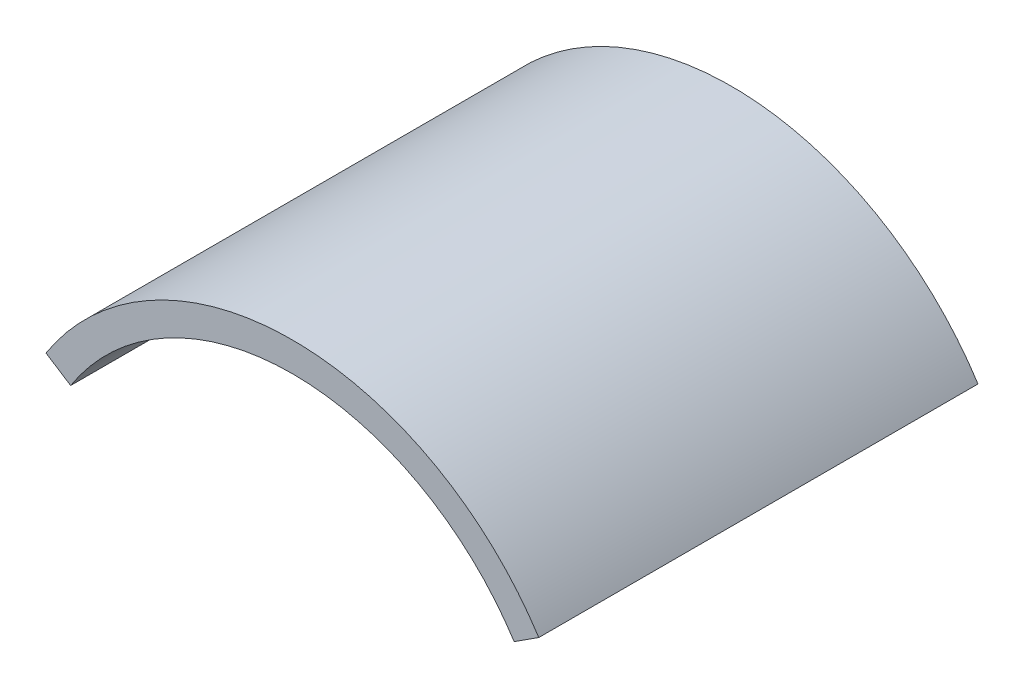
from build123d import *


with BuildPart() as part:
    # Sensor Cover: sweep along a path in Sketch5
    with BuildLine(Plane(origin=(0, 0, 0), x_dir=(1, 0, 0), z_dir=(0, 1, 0))) as sensor_cover_path:
        Line((0, 0), (0, 30))
    # Sketch4 → Sensor Cover (sweep)
    with BuildSketch(Plane.XY):
        with BuildLine():
            Line((-16.829272678, 10.806275082), (-15.14634541, 9.725647574))
            ThreePointArc((-15.14634541, 9.725647574), (0, 18), (15.14634541, 9.725647574))
            Line((15.14634541, 9.725647574), (16.829272678, 10.806275082))
            ThreePointArc((16.829272678, 10.806275082), (0, 20), (-16.829272678, 10.806275082))
        make_face()
    sweep(path=sensor_cover_path.line)


solid = part.part
